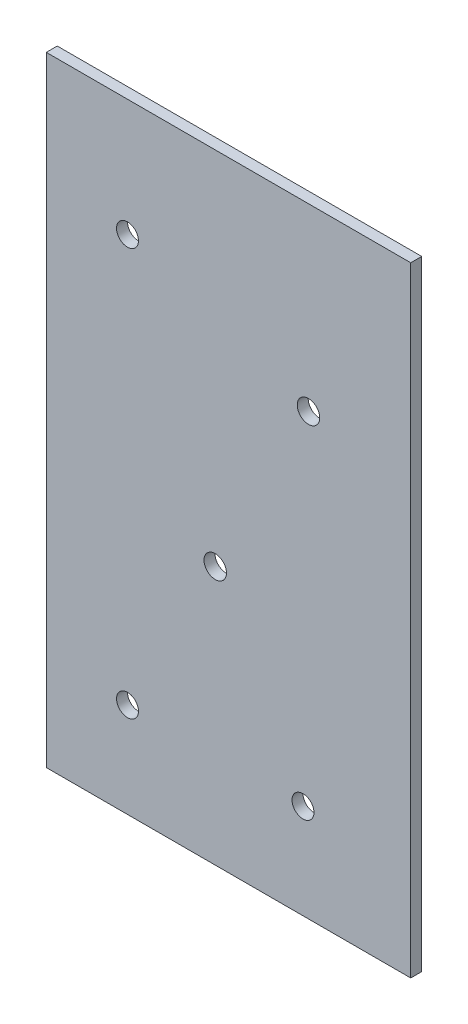
from build123d import *

# Parameters (mm, degrees)
SKETCH1_W           = 105.497827183
SKETCH1_H           = 179.29887024
SKETCH1_R           = 3.175
SKETCH1_R_2         = 3.2512
BOSS_EXTRUDE1_DEPTH = 3.175


with BuildPart() as part:
    # Sketch1 → Boss-Extrude1 (new body)
    with BuildSketch(Plane.XY):
        with Locations((54.6380005, 121.166691813)):
            Rectangle(SKETCH1_W, SKETCH1_H)
        with Locations((25.4, 58.964285714)):
            Circle(SKETCH1_R, mode=Mode.SUBTRACT)
        with Locations((76.2, 58.964285714)):
            Circle(SKETCH1_R, mode=Mode.SUBTRACT)
        with Locations((25.4, 176.892857143)):
            Circle(SKETCH1_R, mode=Mode.SUBTRACT)
        with Locations((77.7875, 158.75)):
            Circle(SKETCH1_R_2, mode=Mode.SUBTRACT)
        with Locations((50.8, 106.3625)):
            Circle(SKETCH1_R_2, mode=Mode.SUBTRACT)
    extrude(amount=BOSS_EXTRUDE1_DEPTH)


solid = part.part
